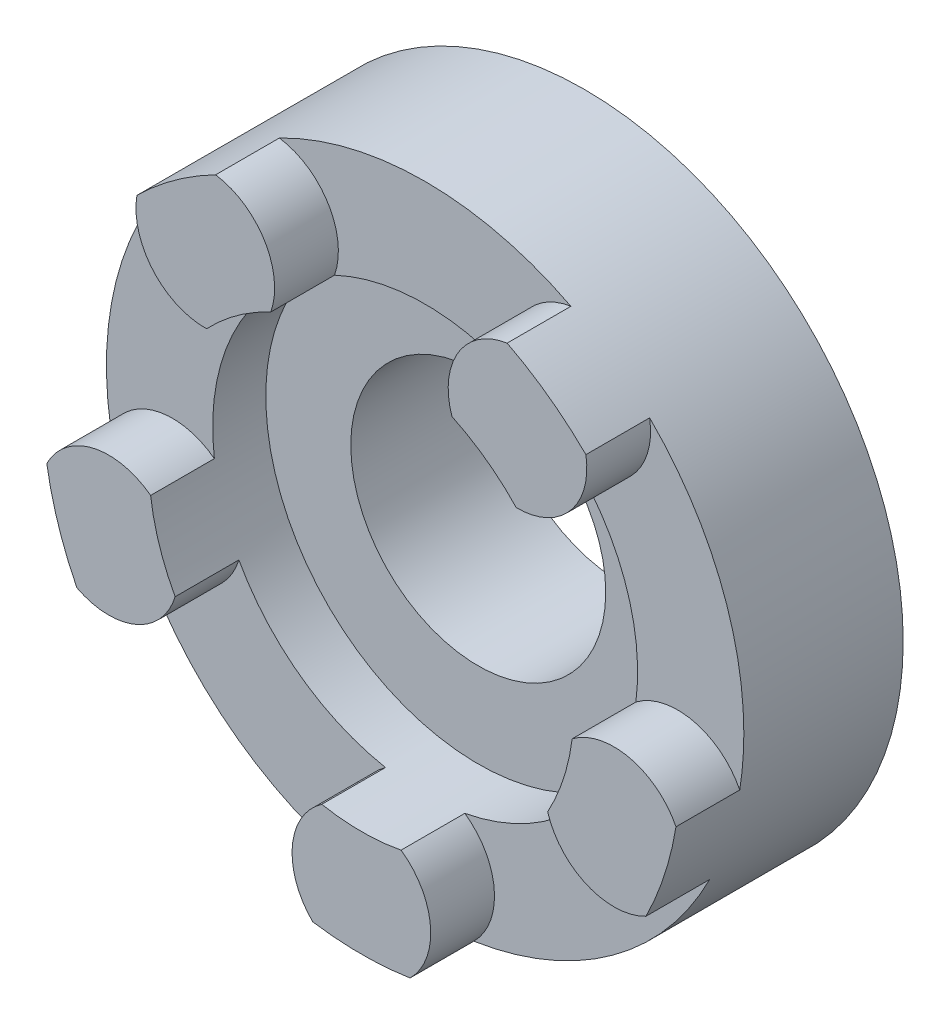
from build123d import *
from build123d.topology import SkipClean

# Parameters (mm, degrees)
SKETCH1_R           = 15
SKETCH1_R_2         = 10
SKETCH1_R_3         = 6
BOSS_EXTRUDE1_DEPTH = 5
BOSS_EXTRUDE2_START = 2.5
SKETCH2_R           = 15
SKETCH2_R_2         = 10
BOSS_EXTRUDE2_DEPTH = 2.5
BOSS_EXTRUDE4_START = 3
BOSS_EXTRUDE4_DEPTH = 3
SKETCH4_R           = 7
SKETCH4_R_2         = 6
BOSS_EXTRUDE5_DEPTH = 1.75


with BuildPart() as part:
    # Sketch1 → Boss-Extrude1 (new body)
    # profile 1 of 2: a face of its own
    with BuildSketch(Plane.XY):
        Circle(SKETCH1_R)
        Circle(SKETCH1_R_2, mode=Mode.SUBTRACT)
    # profile 2 of 2: a face of its own
    with BuildSketch(Plane.XY):
        Circle(SKETCH1_R_2)
        Circle(SKETCH1_R_3, mode=Mode.SUBTRACT)
    extrude(amount=-BOSS_EXTRUDE1_DEPTH)

    # Sketch2 → Boss-Extrude2 (add)
    with BuildSketch(Plane.XY.offset(BOSS_EXTRUDE2_START)):
        Circle(SKETCH2_R)
        Circle(SKETCH2_R_2, mode=Mode.SUBTRACT)
    extrude(amount=-BOSS_EXTRUDE2_DEPTH)

    # Sketch3 → Boss-Extrude4 (add)
    with SkipClean():  # the faces are left unmerged after this step: merging them gives an invalid solid
        with BuildSketch(Plane.XY.offset(2.5).offset(BOSS_EXTRUDE4_START)):
            with BuildLine():
                ThreePointArc((-2.290603582, -14.824072829), (0, -15), (2.290603582, -14.824072829))
                ThreePointArc((2.290603582, -14.824072829), (3.086155614, -13.560105094), (3.235238064, -12.074072829))
                ThreePointArc((3.235238064, -12.074072829), (2.788392741, -10.80499404), (1.867509855, -9.824072829))
                ThreePointArc((1.867509855, -9.824072829), (0, -10), (-1.867509855, -9.824072829))
                ThreePointArc((-1.867509855, -9.824072829), (-2.788392741, -10.80499404), (-3.235238064, -12.074072829))
                ThreePointArc((-3.235238064, -12.074072829), (-3.086155614, -13.560105094), (-2.290603582, -14.824072829))
            make_face()
            with BuildLine():
                ThreePointArc((-14.806366496, -2.402396967), (-14.265847744, -4.635254916), (-13.390695627, -6.759383893))
                ThreePointArc((-13.390695627, -6.759383893), (-11.942751779, -7.125411327), (-10.483382099, -6.807987938))
                ThreePointArc((-10.483382099, -6.807987938), (-9.414499246, -5.990845869), (-8.766156198, -4.811912875))
                ThreePointArc((-8.766156198, -4.811912875), (-9.510565163, -3.090169944), (-9.920340763, -1.259698041))
                ThreePointArc((-9.920340763, -1.259698041), (-11.137820734, -0.687007696), (-12.482869184, -0.654199453))
                ThreePointArc((-12.482869184, -0.654199453), (-13.850100843, -1.255194512), (-14.806366496, -2.402396967))
            make_face()
            with BuildLine():
                ThreePointArc((-6.860234162, 13.339309849), (-8.816778784, 12.135254916), (-10.566508613, 10.64654384))
                ThreePointArc((-10.566508613, 10.64654384), (-10.467182133, 9.15635871), (-9.714324518, 7.866504888))
                ThreePointArc((-9.714324518, 7.866504888), (-8.606873263, 7.102447672), (-7.285292336, 6.850147121))
                ThreePointArc((-7.285292336, 6.850147121), (-5.877852523, 8.090169944), (-4.263597916, 9.045536624))
                ThreePointArc((-4.263597916, 9.045536624), (-4.095159033, 10.380399934), (-4.479599369, 11.669755331))
                ThreePointArc((-4.479599369, 11.669755331), (-5.473677455, 12.784352223), (-6.860234162, 13.339309849))
            make_face()
            with BuildLine():
                ThreePointArc((10.566508613, 10.64654384), (8.816778784, 12.135254916), (6.860234162, 13.339309849))
                ThreePointArc((6.860234162, 13.339309849), (5.473677455, 12.784352223), (4.479599369, 11.669755331))
                ThreePointArc((4.479599369, 11.669755331), (4.095159033, 10.380399934), (4.263597916, 9.045536624))
                ThreePointArc((4.263597916, 9.045536624), (5.877852523, 8.090169944), (7.285292336, 6.850147121))
                ThreePointArc((7.285292336, 6.850147121), (8.606873263, 7.102447672), (9.714324518, 7.866504888))
                ThreePointArc((9.714324518, 7.866504888), (10.467182133, 9.15635871), (10.566508613, 10.64654384))
            make_face()
            with BuildLine():
                ThreePointArc((13.390695627, -6.759383893), (14.265847744, -4.635254916), (14.806366496, -2.402396967))
                ThreePointArc((14.806366496, -2.402396967), (13.850100843, -1.255194512), (12.482869184, -0.654199453))
                ThreePointArc((12.482869184, -0.654199453), (11.137820734, -0.687007696), (9.920340763, -1.259698041))
                ThreePointArc((9.920340763, -1.259698041), (9.510565163, -3.090169944), (8.766156198, -4.811912875))
                ThreePointArc((8.766156198, -4.811912875), (9.414499246, -5.990845869), (10.483382099, -6.807987938))
                ThreePointArc((10.483382099, -6.807987938), (11.942751779, -7.125411327), (13.390695627, -6.759383893))
            make_face()
        extrude(amount=-BOSS_EXTRUDE4_DEPTH)

    # Sketch4 → Boss-Extrude5 (add)
    with SkipClean():  # the faces are left unmerged after this step: merging them gives an invalid solid
        with BuildSketch(Plane(origin=(0, 0, -5), x_dir=(-1, 0, 0), z_dir=(0, 0, -1))):
            with Locations(Location((0, 0, 0), (0, 0, 180))):
                Circle(SKETCH4_R)
            with Locations(Location((0, 0, 0), (0, 0, 180))):
                Circle(SKETCH4_R_2, mode=Mode.SUBTRACT)
        extrude(amount=BOSS_EXTRUDE5_DEPTH)


solid = part.part
